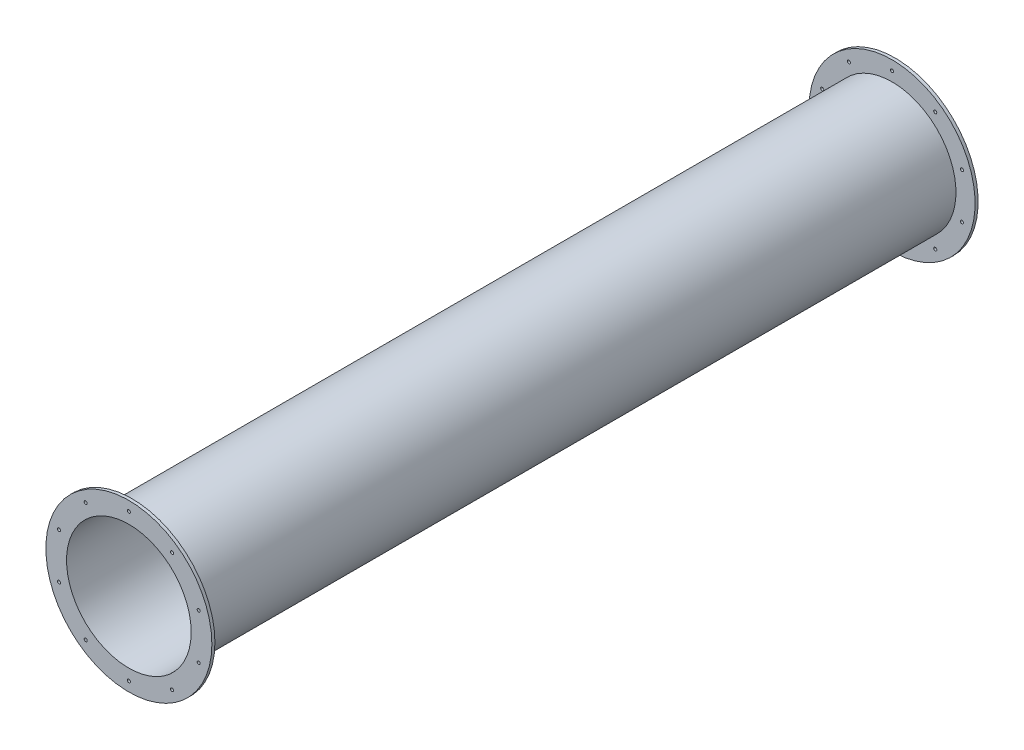
from build123d import *

# Parameters (mm, degrees)
SKETCH1_R           = 250
SKETCH1_R_2         = 244
BOSS_EXTRUDE1_DEPTH = 3000
BOSS_EXTRUDE2_START = -12
SKETCH2_R           = 325
SKETCH2_R_2         = 250
BOSS_EXTRUDE2_DEPTH = 12
SKETCH4_R           = 325
SKETCH4_R_2         = 250
BOSS_EXTRUDE3_DEPTH = 12
SKETCH6_R           = 6
CUT_EXTRUDE3_DEPTH  = 3036.004118613


with BuildPart() as part:
    # Sketch1 → Boss-Extrude1 (new body)
    with BuildSketch(Plane.XY):
        Circle(SKETCH1_R)
        Circle(SKETCH1_R_2, mode=Mode.SUBTRACT)
    extrude(amount=BOSS_EXTRUDE1_DEPTH)

    # Sketch2 → Boss-Extrude2 (add)
    with BuildSketch(Plane.XY.offset(3000).offset(BOSS_EXTRUDE2_START)):
        Circle(SKETCH2_R)
        Circle(SKETCH2_R_2, mode=Mode.SUBTRACT)
    extrude(amount=BOSS_EXTRUDE2_DEPTH)

    # Sketch4 → Boss-Extrude3 (add)
    with BuildSketch(Plane(origin=(0, 0, 0), x_dir=(-1, 0, 0), z_dir=(0, 0, -1))):
        with Locations(Location((0, 0, 0), (0, 0, 180))):
            Circle(SKETCH4_R)
        Circle(SKETCH4_R_2, mode=Mode.SUBTRACT)
    extrude(amount=-BOSS_EXTRUDE3_DEPTH)

    # Sketch6 → Cut-Extrude3 (cut, through all)
    with BuildSketch(Plane.XY.offset(3000)):
        with Locations((0, 287.5)):
            Circle(SKETCH6_R)
        with Locations((168.988260034, 232.592385883)):
            Circle(SKETCH6_R)
        with Locations((273.428748435, 88.842385883)):
            Circle(SKETCH6_R)
        with Locations((273.428748435, -88.842385883)):
            Circle(SKETCH6_R)
        with Locations((168.988260034, -232.592385883)):
            Circle(SKETCH6_R)
        with Locations((0, -287.5)):
            Circle(SKETCH6_R)
        with Locations((-168.988260034, -232.592385883)):
            Circle(SKETCH6_R)
        with Locations((-273.428748435, -88.842385883)):
            Circle(SKETCH6_R)
        with Locations((-273.428748435, 88.842385883)):
            Circle(SKETCH6_R)
        with Locations((-168.988260034, 232.592385883)):
            Circle(SKETCH6_R)
    extrude(amount=-CUT_EXTRUDE3_DEPTH, mode=Mode.SUBTRACT)


solid = part.part
